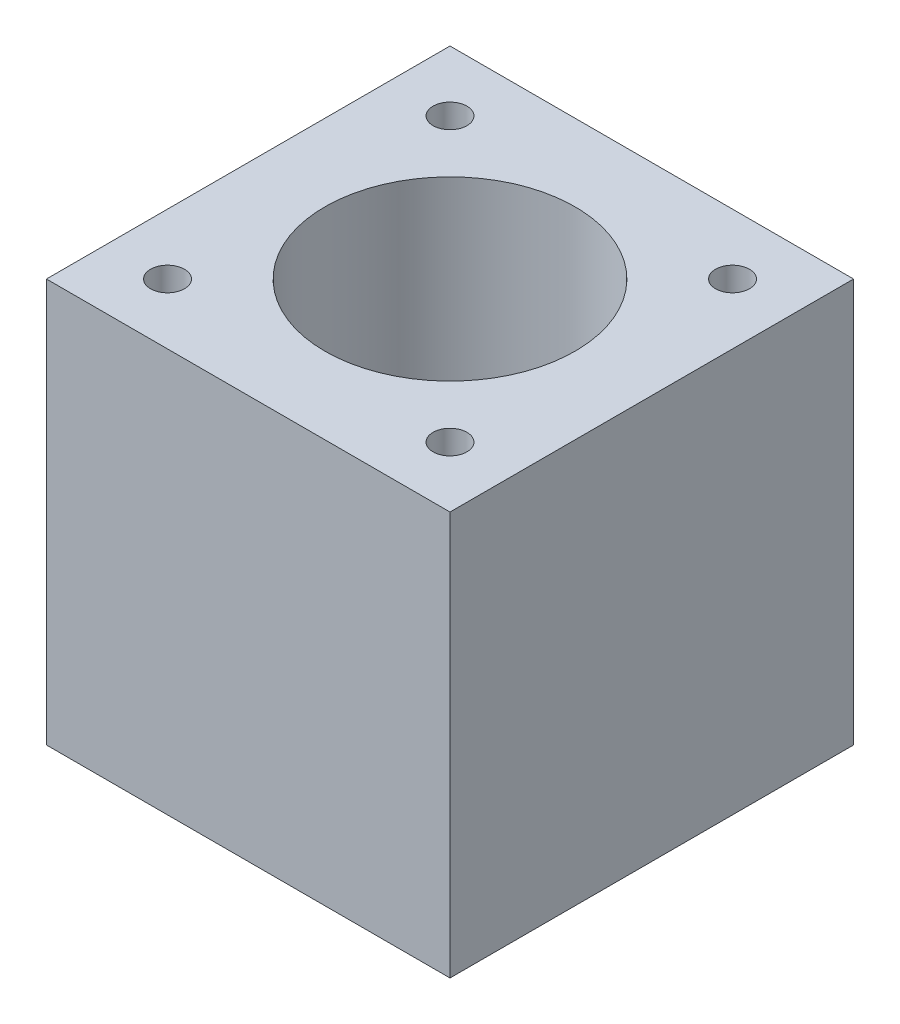
from build123d import *

# Parameters (mm, degrees)
SKETCH2_W           = 50
SKETCH2_H           = 50
BOSS_EXTRUDE1_DEPTH = 50
CUT_EXTRUDE2_REACH  = 88.603
SKETCH5_R           = 2.1
CUT_EXTRUDE3_REACH  = 88.603
SKETCH6_R           = 15.5


with BuildPart() as part:
    # Sketch2 → Boss-Extrude1 (new body)
    with BuildSketch(Plane.XY):
        with Locations((25, 25)):
            Rectangle(SKETCH2_W, SKETCH2_H)
    extrude(amount=BOSS_EXTRUDE1_DEPTH)

    # Sketch5 → Cut-Extrude2 (cut, up to next)
    with BuildSketch(Plane(origin=(0, 50, 0), x_dir=(1, 0, 0), z_dir=(0, 1, 0)), mode=Mode.PRIVATE) as cut_extrude2_sk1:
        with Locations(Location((7.5, -7.5, 0), (0, 0, 270))):
            Circle(SKETCH5_R)
    cut_extrude2_tool1 = extrude(cut_extrude2_sk1.sketch, amount=-CUT_EXTRUDE2_REACH, mode=Mode.PRIVATE) & part.part
    # Sketch5 → Cut-Extrude2 (cut, up to next)
    with BuildSketch(Plane(origin=(0, 50, 0), x_dir=(1, 0, 0), z_dir=(0, 1, 0)), mode=Mode.PRIVATE) as cut_extrude2_sk2:
        with Locations(Location((42.5, -7.5, 0), (0, 0, 270))):
            Circle(SKETCH5_R)
    cut_extrude2_tool2 = extrude(cut_extrude2_sk2.sketch, amount=-CUT_EXTRUDE2_REACH, mode=Mode.PRIVATE) & part.part
    # Sketch5 → Cut-Extrude2 (cut, up to next)
    with BuildSketch(Plane(origin=(0, 50, 0), x_dir=(1, 0, 0), z_dir=(0, 1, 0)), mode=Mode.PRIVATE) as cut_extrude2_sk3:
        with Locations(Location((7.5, -42.5, 0), (0, 0, 270))):
            Circle(SKETCH5_R)
    cut_extrude2_tool3 = extrude(cut_extrude2_sk3.sketch, amount=-CUT_EXTRUDE2_REACH, mode=Mode.PRIVATE) & part.part
    # Sketch5 → Cut-Extrude2 (cut, up to next)
    with BuildSketch(Plane(origin=(0, 50, 0), x_dir=(1, 0, 0), z_dir=(0, 1, 0)), mode=Mode.PRIVATE) as cut_extrude2_sk4:
        with Locations(Location((42.5, -42.5, 0), (0, 0, 270))):
            Circle(SKETCH5_R)
    cut_extrude2_tool4 = extrude(cut_extrude2_sk4.sketch, amount=-CUT_EXTRUDE2_REACH, mode=Mode.PRIVATE) & part.part
    add(cut_extrude2_tool1.solids().sort_by_distance((7.5, 50, 7.5))[0], mode=Mode.SUBTRACT)
    add(cut_extrude2_tool2.solids().sort_by_distance((42.5, 50, 7.5))[0], mode=Mode.SUBTRACT)
    add(cut_extrude2_tool3.solids().sort_by_distance((7.5, 50, 42.5))[0], mode=Mode.SUBTRACT)
    add(cut_extrude2_tool4.solids().sort_by_distance((42.5, 50, 42.5))[0], mode=Mode.SUBTRACT)

    # Sketch6 → Cut-Extrude3 (cut, up to next)
    with BuildSketch(Plane(origin=(0, 50, 0), x_dir=(-1, 0, 0), z_dir=(0, 1, 0)), mode=Mode.PRIVATE) as cut_extrude3_sk1:
        with Locations(Location((-25, 25, 0), (0, 0, 90))):
            Circle(SKETCH6_R)
    cut_extrude3_tool1 = extrude(cut_extrude3_sk1.sketch, amount=-CUT_EXTRUDE3_REACH, mode=Mode.PRIVATE) & part.part
    add(cut_extrude3_tool1.solids().sort_by_distance((25, 50, 25))[0], mode=Mode.SUBTRACT)


solid = part.part
